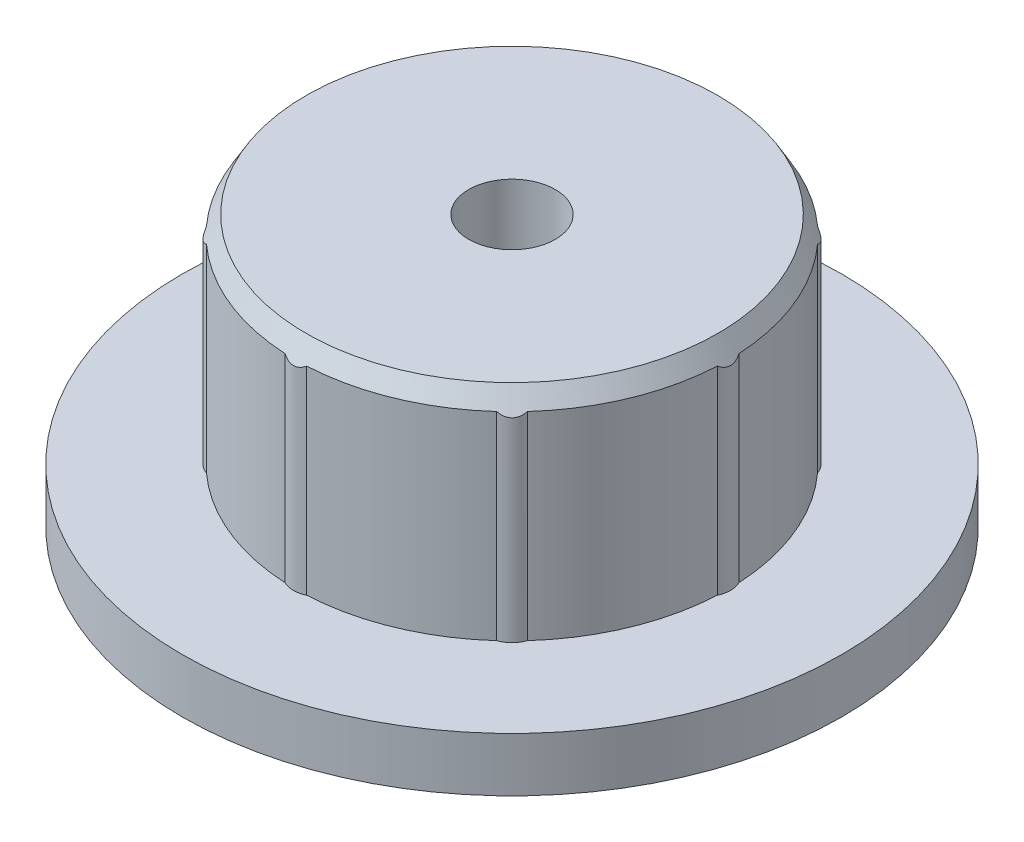
from build123d import *

# Parameters (mm, degrees)
BOSS_EXTRUDE1_DEPTH = 20
SKETCH3_R           = 30.48
BOSS_EXTRUDE2_DEPTH = 5
SKETCH11_R          = 4
CUT_EXTRUDE2_DEPTH  = 50.830320087


with BuildPart() as part:
    # Sketch1 → Boss-Extrude1 (new body)
    with BuildSketch(Plane(origin=(0, 0, 0), x_dir=(1, 0, 0), z_dir=(0, 1, 0))):
        with BuildLine():
            ThreePointArc((-1, 19.974984355), (-7.653668647, 18.47759065), (-13.417340111, 14.831553673))
            ThreePointArc((-13.417340111, 14.831553673), (-14.28355698, 14.28355698), (-14.831553673, 13.417340111))
            ThreePointArc((-14.831553673, 13.417340111), (-18.47759065, 7.653668647), (-19.974984355, 1))
            ThreePointArc((-19.974984355, 1), (-20.2, 0), (-19.974984355, -1))
            ThreePointArc((-19.974984355, -1), (-18.47759065, -7.653668647), (-14.831553673, -13.417340111))
            ThreePointArc((-14.831553673, -13.417340111), (-14.28355698, -14.28355698), (-13.417340111, -14.831553673))
            ThreePointArc((-13.417340111, -14.831553673), (-7.653668647, -18.47759065), (-1, -19.974984355))
            ThreePointArc((-1, -19.974984355), (0, -20.2), (1, -19.974984355))
            ThreePointArc((1, -19.974984355), (7.653668647, -18.47759065), (13.417340111, -14.831553673))
            ThreePointArc((13.417340111, -14.831553673), (14.28355698, -14.28355698), (14.831553673, -13.417340111))
            ThreePointArc((14.831553673, -13.417340111), (18.47759065, -7.653668647), (19.974984355, -1))
            ThreePointArc((19.974984355, -1), (20.2, 0), (19.974984355, 1))
            ThreePointArc((19.974984355, 1), (18.47759065, 7.653668647), (14.831553673, 13.417340111))
            ThreePointArc((14.831553673, 13.417340111), (14.28355698, 14.28355698), (13.417340111, 14.831553673))
            ThreePointArc((13.417340111, 14.831553673), (7.653668647, 18.47759065), (1, 19.974984355))
            ThreePointArc((1, 19.974984355), (0, 20.2), (-1, 19.974984355))
        make_face()
    extrude(amount=BOSS_EXTRUDE1_DEPTH)

    # Sketch2 → Cut-Revolve1 (revolve, cut)
    with BuildSketch(Plane.XY, mode=Mode.PRIVATE) as cut_revolve1_sk:
        Polygon((-18.61228676, 20.75), (-20.724984355, 17.090700423), (-20.724984355, 20.75), align=None)
    revolve(cut_revolve1_sk.sketch.rotate(Axis((0, 0, 0), (0, 1, 0)), 270), axis=Axis((0, 0, 0), (0, 1, 0)), mode=Mode.SUBTRACT)

    # Sketch3 → Boss-Extrude2 (add)
    with BuildSketch(Plane.XZ):
        with Locations(Location((0, 0, 0), (0, 0, 270))):
            Circle(SKETCH3_R)
    extrude(amount=BOSS_EXTRUDE2_DEPTH)

    # Sketch11 → Cut-Extrude2 (cut, through all)
    with BuildSketch(Plane(origin=(0, 20, 0), x_dir=(1, 0, 0), z_dir=(0, 1, 0))):
        with Locations(Location((0, 0, 0), (0, 0, 270))):
            Circle(SKETCH11_R)
    extrude(amount=-CUT_EXTRUDE2_DEPTH, mode=Mode.SUBTRACT)


solid = part.part
